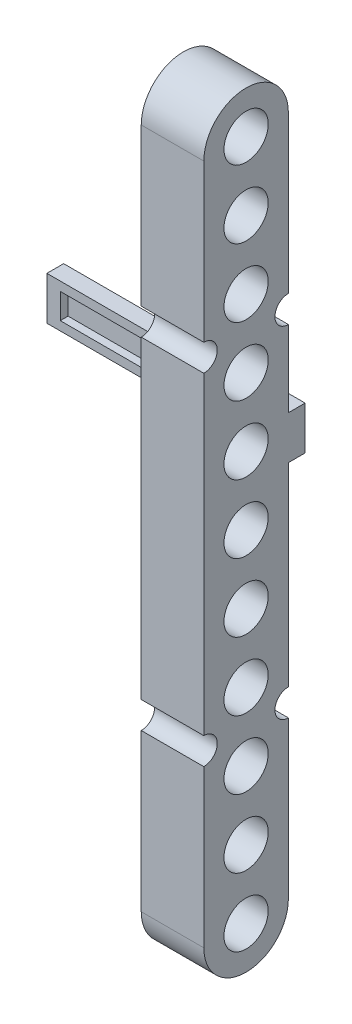
from build123d import *

# Parameters (mm, degrees)
SKETCH_1_R      = 4.95
EXTRUDE_1_DEPTH = 14
SKETCH_3_W      = 14
SKETCH_3_H      = 60.948164725
EXTRUDE_2_DEPTH = 3
SKETCH_4_R      = 4.95
EXTRUDE_3_DEPTH = 14
SKETCH_5_W      = 49
SKETCH_5_H      = 5.67
EXTRUDE_4_DEPTH = 1.75
EXTRUDE_5_DEPTH = 2


with BuildPart() as part:
    # Эскиз1 → Бобышка-Вытянуть1 (new body)
    with BuildSketch(Plane(origin=(0, 0, 0), x_dir=(0, 0, -1), z_dir=(1, 0, 0))):
        with BuildLine():
            Line((6.45, 38.092602953), (6.45, 53.329644134))
            ThreePointArc((6.45, 53.329644134), (0, 59.779644134), (-6.45, 53.329644134))
            Line((-6.45, 53.329644134), (-6.45, 38.092602953))
            Line((-6.45, 38.092602953), (-6.45, 22.855561772))
            Line((-6.45, 22.855561772), (-6.45, 7.618520591))
            Line((-6.45, 7.618520591), (-6.45, -7.618520591))
            ThreePointArc((-6.45, -7.618520591), (0, -14.068520591), (6.45, -7.618520591))
            Line((6.45, -7.618520591), (6.45, 7.618520591))
            Line((6.45, 7.618520591), (6.45, 22.855561772))
            Line((6.45, 22.855561772), (6.45, 38.092602953))
        make_face()
        with Locations((0, 7.618520591)):
            Circle(SKETCH_1_R, mode=Mode.SUBTRACT)
        with Locations((0, -7.618520591)):
            Circle(SKETCH_1_R, mode=Mode.SUBTRACT)
        with Locations((0, 22.855561772)):
            Circle(SKETCH_1_R, mode=Mode.SUBTRACT)
        with Locations((0, 38.092602953)):
            Circle(SKETCH_1_R, mode=Mode.SUBTRACT)
        with Locations((0, 53.329644134)):
            Circle(SKETCH_1_R, mode=Mode.SUBTRACT)
    extrude(amount=EXTRUDE_1_DEPTH)

    # Эскиз3 → Бобышка-Вытянуть2 (add)
    with BuildSketch(Plane(origin=(0, 0, -6.45), x_dir=(-1, 0, 0), z_dir=(0, 0, -1))):
        with Locations((-7, 22.855561772)):
            Rectangle(SKETCH_3_W, SKETCH_3_H)
    extrude(amount=EXTRUDE_2_DEPTH)

    # Эскиз4 → Бобышка-Вытянуть3 (add)
    with BuildSketch(Plane.ZY):
        with BuildLine():
            Line((-9.45, 53.329644134), (-9.45, 57.948164724))
            ThreePointArc((-9.45, 57.948164724), (-6.45, 60.948164724), (-9.45, 63.948164724))
            Line((-9.45, 63.948164724), (-9.45, 99.040767677))
            ThreePointArc((-9.45, 99.040767677), (0, 108.490767677), (9.45, 99.040767677))
            Line((9.45, 99.040767677), (9.45, 63.948164724))
            ThreePointArc((9.45, 63.948164724), (6.45, 60.948164724), (9.45, 57.948164724))
            Line((9.45, 57.948164724), (9.45, -12.237041181))
            ThreePointArc((9.45, -12.237041181), (6.45, -15.237041181), (9.45, -18.237041181))
            Line((9.45, -18.237041181), (9.45, -53.329644134))
            ThreePointArc((9.45, -53.329644134), (0, -62.779644134), (-9.45, -53.329644134))
            Line((-9.45, -53.329644134), (-9.45, -18.237041181))
            ThreePointArc((-9.45, -18.237041181), (-6.45, -15.237041181), (-9.45, -12.237041181))
            Line((-9.45, -12.237041181), (-9.45, 53.329644134))
        make_face()
        with Locations((0, 99.040767677)):
            Circle(SKETCH_4_R, mode=Mode.SUBTRACT)
        with Locations((0, 83.803726496)):
            Circle(SKETCH_4_R, mode=Mode.SUBTRACT)
        with Locations((0, 68.566685315)):
            Circle(SKETCH_4_R, mode=Mode.SUBTRACT)
        with Locations(Location((0, 53.329644134, 0), (0, 0, 180))):
            Circle(SKETCH_4_R, mode=Mode.SUBTRACT)
        with Locations((0, -53.329644134)):
            Circle(SKETCH_4_R, mode=Mode.SUBTRACT)
        with Locations((0, -38.092602953)):
            Circle(SKETCH_4_R, mode=Mode.SUBTRACT)
        with Locations((0, -22.855561772)):
            Circle(SKETCH_4_R, mode=Mode.SUBTRACT)
        with Locations(Location((0, -7.618520591, 0), (0, 0, 180))):
            Circle(SKETCH_4_R, mode=Mode.SUBTRACT)
        with Locations(Location((0, 38.092602953, 0), (0, 0, 180))):
            Circle(SKETCH_4_R, mode=Mode.SUBTRACT)
        with Locations(Location((0, 22.855561772, 0), (0, 0, 180))):
            Circle(SKETCH_4_R, mode=Mode.SUBTRACT)
        with Locations(Location((0, 7.618520591, 0), (0, 0, 180))):
            Circle(SKETCH_4_R, mode=Mode.SUBTRACT)
    extrude(amount=-EXTRUDE_3_DEPTH)

    # Эскиз5 → Бобышка-Вытянуть4 (add)
    with BuildSketch(Plane(origin=(0, 0, -9.45), x_dir=(-1, 0, 0), z_dir=(0, 0, -1))):
        Polygon((-14, 31.185355866), (-14, 40.855355866), (39, 40.855355866), (40, 40.855355866), (40, 31.185355866), (39, 31.185355866), align=None)
        with Locations((12.5, 36.020355866)):
            Rectangle(SKETCH_5_W, SKETCH_5_H, mode=Mode.SUBTRACT)
    extrude(amount=EXTRUDE_4_DEPTH)

    # Эскиз6 → Бобышка-Вытянуть5 (add)
    with BuildSketch(Plane(origin=(0, 0, -11.2), x_dir=(-1, 0, 0), z_dir=(0, 0, -1))):
        Polygon((39, 31.185355866), (-14, 31.185355866), (-14, 40.855355866), (39, 40.855355866), (40, 40.855355866), (40, 31.185355866), align=None)
    extrude(amount=EXTRUDE_5_DEPTH)


solid = part.part
